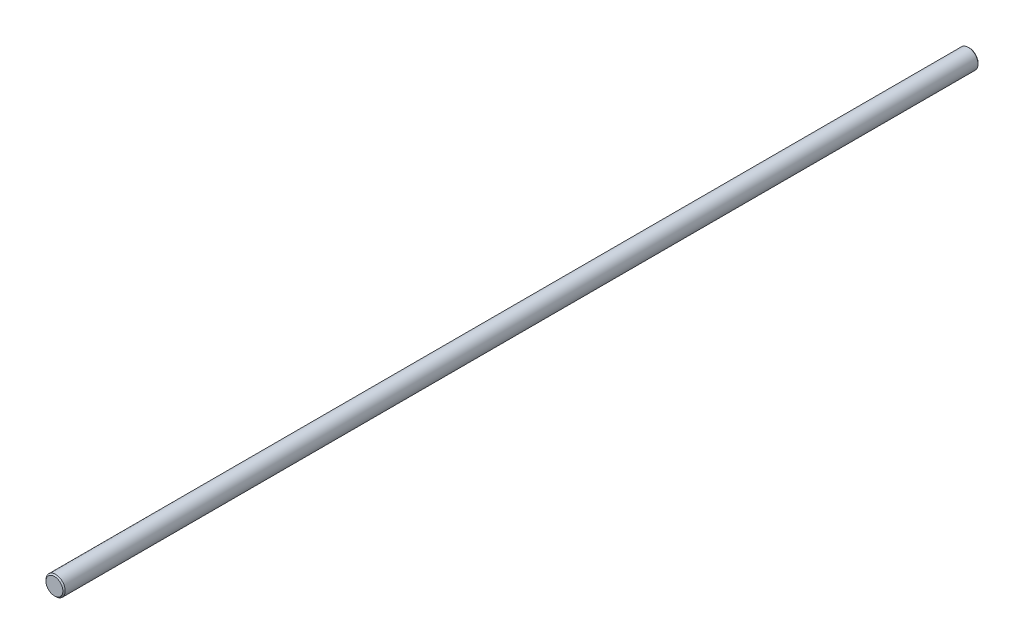
from build123d import *

# Parameters (mm, degrees)
SKETCH1_R      = 4
EXTRUDE1_DEPTH = 380
CHAMFER1_SIZE  = 0.5


with BuildPart() as part:
    # Sketch1 → Extrude1 (new body)
    with BuildSketch(Plane.XY):
        Circle(SKETCH1_R)
    extrude(amount=EXTRUDE1_DEPTH)

    # Chamfer1
    chamfer1_edges = [part.edges().sort_by_distance(p)[0] for p in [
        (-4, 0, 0),
        (-4, 0, 380),
    ]]
    chamfer(chamfer1_edges, length=CHAMFER1_SIZE)


solid = part.part
